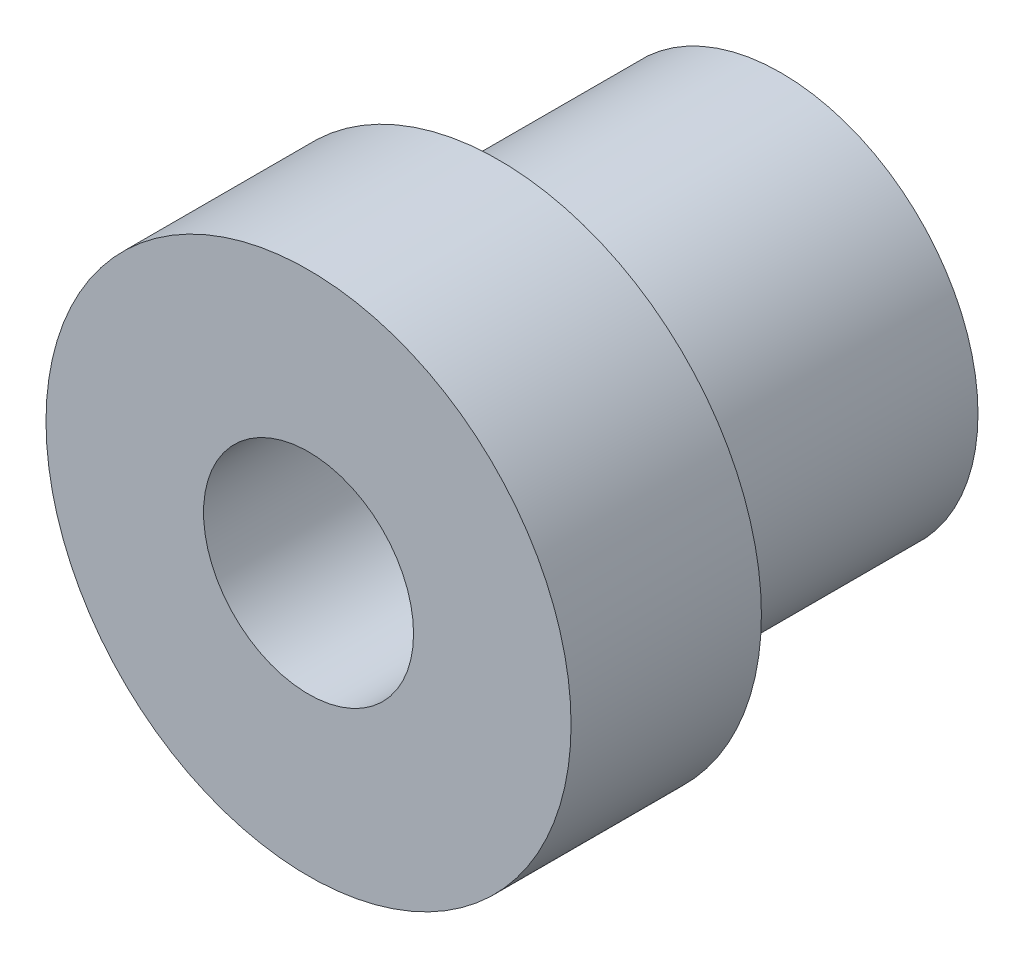
from build123d import *

# Parameters (mm, degrees)
SKETCH_1_R          = 4
EXTRUDE_1_DEPTH     = 7
SKETCH_2_R          = 1.6
CUT_EXTRUDE_1_DEPTH = 10
SKETCH_3_OUTSIDE_W  = 12.66
SKETCH_3_OUTSIDE_H  = 12.66
SKETCH_3_OUTSIDE_R  = 3
CUT_EXTRUDE_2_DEPTH = 4
SKETCH_4_R          = 4
SKETCH_4_R_2        = 1.6
EXTRUDE_2_DEPTH     = 3
SKETCH_5_R          = 4
SKETCH_5_R_2        = 3
CUT_EXTRUDE_3_DEPTH = 2.1
SKETCH_6_OUTSIDE_W  = 13.02
SKETCH_6_OUTSIDE_H  = 13.02
SKETCH_6_OUTSIDE_R  = 3
CUT_EXTRUDE_4_DEPTH = 7
SKETCH_7_R          = 3
CUT_EXTRUDE_5_DEPTH = 2.8


with BuildPart() as part:
    # 草图1 → 凸台-拉伸1 (new body)
    with BuildSketch(Plane.XY):
        Circle(SKETCH_1_R)
    extrude(amount=EXTRUDE_1_DEPTH)

    # 草图2 → 切除-拉伸1 (cut, through all)
    with BuildSketch(Plane.XY.offset(7)):
        Circle(SKETCH_2_R)
    extrude(amount=-CUT_EXTRUDE_1_DEPTH, mode=Mode.SUBTRACT)

    # 草图3 outside → 切除-拉伸2 (cut)
    with BuildSketch(Plane.XY.offset(7)):
        Rectangle(SKETCH_3_OUTSIDE_W, SKETCH_3_OUTSIDE_H)
        Circle(SKETCH_3_OUTSIDE_R, mode=Mode.SUBTRACT)
    extrude(amount=-CUT_EXTRUDE_2_DEPTH, mode=Mode.SUBTRACT)

    # 草图4 → 凸台-拉伸2 (add)
    with BuildSketch(Plane.XY.offset(7)):
        Circle(SKETCH_4_R)
        Circle(SKETCH_4_R_2, mode=Mode.SUBTRACT)
    extrude(amount=EXTRUDE_2_DEPTH)

    # 草图5 → 切除-拉伸3 (cut, symmetric)
    with BuildSketch(Plane.XY.offset(5)):
        Circle(SKETCH_5_R)
        Circle(SKETCH_5_R_2, mode=Mode.SUBTRACT)
    extrude(amount=CUT_EXTRUDE_3_DEPTH, both=True, mode=Mode.SUBTRACT)

    # 草图6 outside → 切除-拉伸4 (cut)
    with BuildSketch(Plane(origin=(0, 0, 0), x_dir=(-1, 0, 0), z_dir=(0, 0, -1))):
        Rectangle(SKETCH_6_OUTSIDE_W, SKETCH_6_OUTSIDE_H)
        with Locations(Location((0, 0, 0), (0, 0, 180))):
            Circle(SKETCH_6_OUTSIDE_R, mode=Mode.SUBTRACT)
    extrude(amount=-CUT_EXTRUDE_4_DEPTH, mode=Mode.SUBTRACT)

    # 草图7 → 切除-拉伸5 (cut)
    with BuildSketch(Plane(origin=(0, 0, 0), x_dir=(-1, 0, 0), z_dir=(0, 0, -1))):
        with Locations(Location((0, 0, 0), (0, 0, 180))):
            Circle(SKETCH_7_R)
    extrude(amount=-CUT_EXTRUDE_5_DEPTH, mode=Mode.SUBTRACT)


solid = part.part
